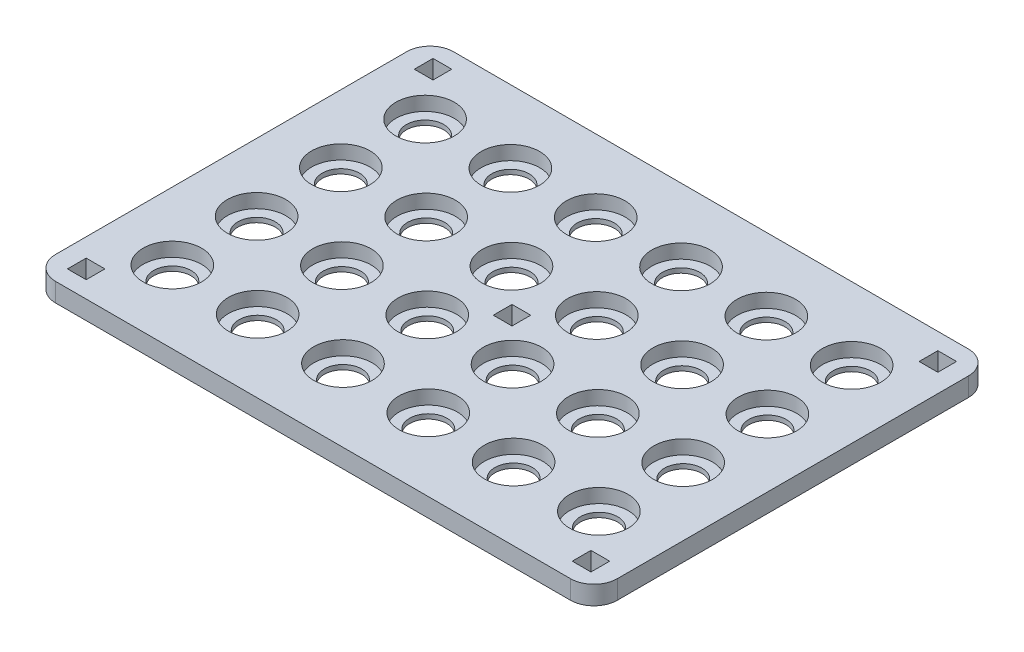
from build123d import *

# Parameters (mm, degrees)
SKETCH1_W               = 120
SKETCH1_H               = 85
BOSS_EXTRUDE1_DEPTH     = 17.5
SKETCH2_R               = 6.25
CUT_EXTRUDE1_DEPTH      = 34
SKETCH5_R               = 4
CUT_EXTRUDE4_DEPTH      = 82.432487375
FILLET1_R               = 5
SKETCH3_W               = 104.211367546
SKETCH3_H               = 27
CUT_EXTRUDE2_DEPTH      = 106.50473923
SKETCH4_W               = 69.558922102
SKETCH4_H               = 27
CUT_EXTRUDE3_DEPTH      = 129.500972759
SKETCH6_W               = 4
SKETCH6_H               = 4
BOSS_EXTRUDE2_DEPTH     = 35
CHAMFER1_SIZE           = 1
CHAMFER3_SIZE           = 1
CUT_EXTRUDE8_DEPTH      = 76.581082289
CUT_EXTRUDE8_DEPTH_BACK = 13.5
SKETCH10_W              = 127.378136422
SKETCH10_H              = 96.398058909
SKETCH11_W              = 4
SKETCH11_H              = 4
CUT_EXTRUDE9_DEPTH      = 82.432487375


with BuildPart() as part:
    # Sketch1 → Boss-Extrude1 (new, symmetric)
    with BuildSketch(Plane(origin=(0, 0, 0), x_dir=(1, 0, 0), z_dir=(0, 1, 0))):
        Rectangle(SKETCH1_W, SKETCH1_H)
    extrude(amount=BOSS_EXTRUDE1_DEPTH, both=True)

    # Sketch2 → Cut-Extrude1 (cut)
    with BuildSketch(Plane(origin=(0, 17.5, 0), x_dir=(1, 0, 0), z_dir=(0, 1, 0))):
        with Locations(Location((-45.56575, 27, 0), (0, 0, 270))):
            Circle(SKETCH2_R)
        with Locations(Location((-27.33945, 27, 0), (0, 0, 270))):
            Circle(SKETCH2_R)
        with Locations(Location((-9.11315, 27, 0), (0, 0, 270))):
            Circle(SKETCH2_R)
        with Locations(Location((9.11315, 27, 0), (0, 0, 270))):
            Circle(SKETCH2_R)
        with Locations(Location((27.33945, 27, 0), (0, 0, 270))):
            Circle(SKETCH2_R)
        with Locations(Location((45.56575, 27, 0), (0, 0, 270))):
            Circle(SKETCH2_R)
        with Locations(Location((-27.33945, 9, 0), (0, 0, 270))):
            Circle(SKETCH2_R)
        with Locations(Location((-9.11315, 9, 0), (0, 0, 270))):
            Circle(SKETCH2_R)
        with Locations(Location((9.11315, 9, 0), (0, 0, 270))):
            Circle(SKETCH2_R)
        with Locations(Location((27.33945, 9, 0), (0, 0, 270))):
            Circle(SKETCH2_R)
        with Locations(Location((45.56575, 9, 0), (0, 0, 270))):
            Circle(SKETCH2_R)
        with Locations(Location((-27.33945, -9, 0), (0, 0, 270))):
            Circle(SKETCH2_R)
        with Locations(Location((-9.11315, -9, 0), (0, 0, 270))):
            Circle(SKETCH2_R)
        with Locations(Location((9.11315, -9, 0), (0, 0, 270))):
            Circle(SKETCH2_R)
        with Locations(Location((27.33945, -9, 0), (0, 0, 270))):
            Circle(SKETCH2_R)
        with Locations(Location((45.56575, -9, 0), (0, 0, 270))):
            Circle(SKETCH2_R)
        with Locations(Location((-27.33945, -27, 0), (0, 0, 270))):
            Circle(SKETCH2_R)
        with Locations(Location((-9.11315, -27, 0), (0, 0, 270))):
            Circle(SKETCH2_R)
        with Locations(Location((9.11315, -27, 0), (0, 0, 270))):
            Circle(SKETCH2_R)
        with Locations(Location((27.33945, -27, 0), (0, 0, 270))):
            Circle(SKETCH2_R)
        with Locations(Location((45.56575, -27, 0), (0, 0, 270))):
            Circle(SKETCH2_R)
        with Locations(Location((-45.56575, 9, 0), (0, 0, 270))):
            Circle(SKETCH2_R)
        with Locations(Location((-45.56575, -9, 0), (0, 0, 270))):
            Circle(SKETCH2_R)
        with Locations(Location((-45.56575, -27, 0), (0, 0, 270))):
            Circle(SKETCH2_R)
    extrude(amount=-CUT_EXTRUDE1_DEPTH, mode=Mode.SUBTRACT)

    # Sketch5 → Cut-Extrude4 (cut, through all)
    with BuildSketch(Plane(origin=(0, 17.5, 0), x_dir=(1, 0, 0), z_dir=(0, 1, 0))):
        with Locations(Location((-45.56575, 27, 0), (0, 0, 270))):
            Circle(SKETCH5_R)
        with Locations(Location((-27.336055, 27, 0), (0, 0, 270))):
            Circle(SKETCH5_R)
        with Locations(Location((-9.10636, 27, 0), (0, 0, 270))):
            Circle(SKETCH5_R)
        with Locations(Location((9.123335, 27, 0), (0, 0, 270))):
            Circle(SKETCH5_R)
        with Locations(Location((27.35303, 27, 0), (0, 0, 270))):
            Circle(SKETCH5_R)
        with Locations(Location((45.582725, 27, 0), (0, 0, 270))):
            Circle(SKETCH5_R)
        with Locations(Location((-27.336055, 9, 0), (0, 0, 270))):
            Circle(SKETCH5_R)
        with Locations(Location((-9.10636, 9, 0), (0, 0, 270))):
            Circle(SKETCH5_R)
        with Locations(Location((9.123335, 9, 0), (0, 0, 270))):
            Circle(SKETCH5_R)
        with Locations(Location((27.35303, 9, 0), (0, 0, 270))):
            Circle(SKETCH5_R)
        with Locations(Location((45.582725, 9, 0), (0, 0, 270))):
            Circle(SKETCH5_R)
        with Locations(Location((-27.336055, -9, 0), (0, 0, 270))):
            Circle(SKETCH5_R)
        with Locations(Location((-9.10636, -9, 0), (0, 0, 270))):
            Circle(SKETCH5_R)
        with Locations(Location((9.123335, -9, 0), (0, 0, 270))):
            Circle(SKETCH5_R)
        with Locations(Location((27.35303, -9, 0), (0, 0, 270))):
            Circle(SKETCH5_R)
        with Locations(Location((45.582725, -9, 0), (0, 0, 270))):
            Circle(SKETCH5_R)
        with Locations(Location((-27.336055, -27, 0), (0, 0, 270))):
            Circle(SKETCH5_R)
        with Locations(Location((-9.10636, -27, 0), (0, 0, 270))):
            Circle(SKETCH5_R)
        with Locations(Location((9.123335, -27, 0), (0, 0, 270))):
            Circle(SKETCH5_R)
        with Locations(Location((27.35303, -27, 0), (0, 0, 270))):
            Circle(SKETCH5_R)
        with Locations(Location((45.582725, -27, 0), (0, 0, 270))):
            Circle(SKETCH5_R)
        with Locations(Location((-45.56575, 9, 0), (0, 0, 270))):
            Circle(SKETCH5_R)
        with Locations(Location((-45.56575, -9, 0), (0, 0, 270))):
            Circle(SKETCH5_R)
        with Locations(Location((-45.56575, -27, 0), (0, 0, 270))):
            Circle(SKETCH5_R)
    extrude(amount=-CUT_EXTRUDE4_DEPTH, mode=Mode.SUBTRACT)

    # Fillet1
    fillet1_edges = [part.edges().sort_by_distance(p)[0] for p in [
        (60, 0, 42.5),
        (-60, 0, 42.5),
        (-60, 0, -42.5),
        (60, 0, -42.5),
    ]]
    fillet(fillet1_edges, radius=FILLET1_R)

    # Sketch3 → Cut-Extrude2 (cut, through all)
    with BuildSketch(Plane(origin=(0, 0, -42.5), x_dir=(-1, 0, 0), z_dir=(0, 0, -1))):
        Rectangle(SKETCH3_W, SKETCH3_H)
    extrude(amount=-CUT_EXTRUDE2_DEPTH, mode=Mode.SUBTRACT)

    # Sketch4 → Cut-Extrude3 (cut, through all)
    with BuildSketch(Plane(origin=(60, 0, 0), x_dir=(0, 0, -1), z_dir=(1, 0, 0))):
        Rectangle(SKETCH4_W, SKETCH4_H)
    extrude(amount=-CUT_EXTRUDE3_DEPTH, mode=Mode.SUBTRACT)

    # Sketch6 → Boss-Extrude2 (add)
    with BuildSketch(Plane(origin=(0, 17.5, 0), x_dir=(1, 0, 0), z_dir=(0, 1, 0))):
        Rectangle(SKETCH6_W, SKETCH6_H)
    extrude(amount=-BOSS_EXTRUDE2_DEPTH)

    # Chamfer1
    chamfer1_edges = [part.edges().sort_by_distance(p)[0] for p in [
        (0, 13.5, -2),
        (-2, 13.5, 0),
        (0, 13.5, 2),
        (2, 13.5, 0),
        (2, -13.5, 0),
        (0, -13.5, 2),
        (-2, -13.5, 0),
        (0, -13.5, -2),
    ]]
    chamfer(chamfer1_edges, length=CHAMFER1_SIZE)

    # Chamfer3
    chamfer3_edges = [part.edges().sort_by_distance(p)[0] for p in [
        (-45.56575, 17.5, -33.25),
        (-27.33945, 17.5, -33.25),
        (-9.11315, 17.5, -33.25),
        (9.11315, 17.5, -33.25),
        (27.33945, 17.5, -33.25),
        (45.56575, 17.5, -33.25),
        (-27.33945, 17.5, -15.25),
        (-9.11315, 17.5, -15.25),
        (9.11315, 17.5, -15.25),
        (27.33945, 17.5, -15.25),
        (45.56575, 17.5, -15.25),
        (-27.33945, 17.5, 2.75),
        (-9.11315, 17.5, 2.75),
        (9.11315, 17.5, 2.75),
        (27.33945, 17.5, 2.75),
        (45.56575, 17.5, 2.75),
        (-27.33945, 17.5, 20.75),
        (-9.11315, 17.5, 20.75),
        (9.11315, 17.5, 20.75),
        (27.33945, 17.5, 20.75),
        (45.56575, 17.5, 20.75),
        (-45.56575, 17.5, -15.25),
        (-45.56575, 17.5, 2.75),
        (-45.56575, 17.5, 20.75),
    ]]
    chamfer(chamfer3_edges, length=CHAMFER3_SIZE)

    # Sketch10 → Cut-Extrude8 (cut, two sides: drawn at the far end of the back side and taken through both)
    with BuildSketch(Plane(origin=(0, 0, 0), x_dir=(1, 0, 0), z_dir=(0, 1, 0)).offset(-CUT_EXTRUDE8_DEPTH_BACK)):
        with Locations((-1.294046217, -0.232811032)):
            Rectangle(SKETCH10_W, SKETCH10_H)
    extrude(amount=CUT_EXTRUDE8_DEPTH + CUT_EXTRUDE8_DEPTH_BACK, mode=Mode.SUBTRACT)

    # Sketch11 → Cut-Extrude9 (cut, through all)
    with BuildSketch(Plane(origin=(0, 17.5, 0), x_dir=(1, 0, 0), z_dir=(0, 1, 0))):
        with Locations((-54.051771282, -36.924441912)):
            Rectangle(SKETCH11_W, SKETCH11_H)
        with Locations((53.948228718, -37.075558088)):
            Rectangle(SKETCH11_W, SKETCH11_H)
        with Locations((54.051771282, 36.924441912)):
            Rectangle(SKETCH11_W, SKETCH11_H)
        with Locations((-53.948228718, 37.075558088)):
            Rectangle(SKETCH11_W, SKETCH11_H)
        Rectangle(SKETCH11_W, SKETCH11_H)
    extrude(amount=-CUT_EXTRUDE9_DEPTH, mode=Mode.SUBTRACT)


solid = part.part
